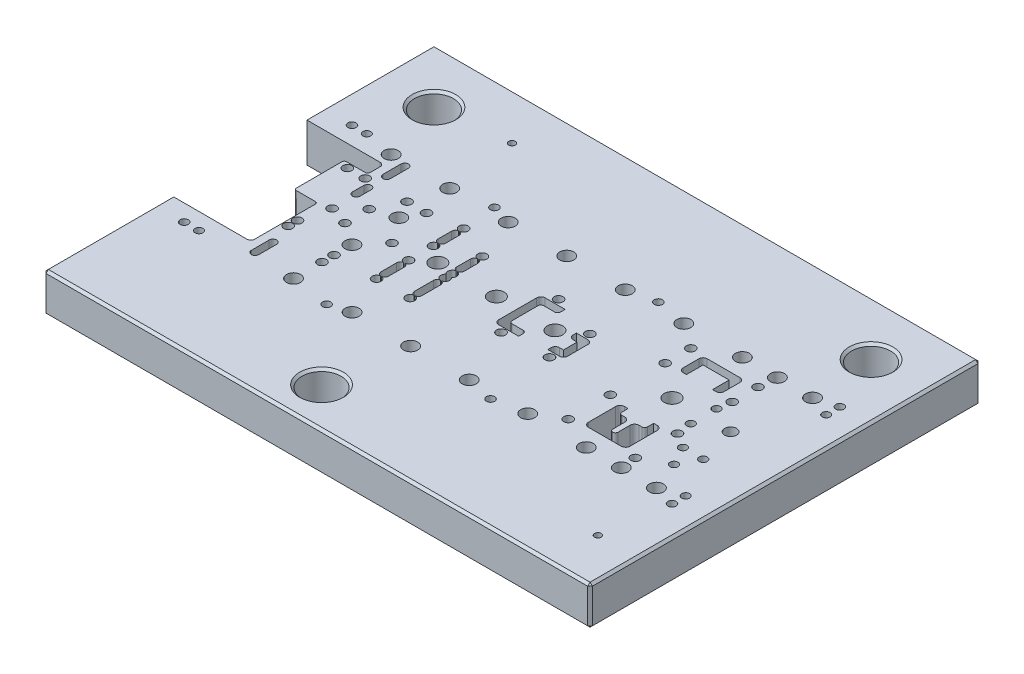
from build123d import *

# Parameters (mm, degrees)
SKETCH1_W                                            = 700
SKETCH1_H                                            = 500
BOSS_EXTRUDE1_DEPTH                                  = 50
CUT_EXTRUDE1_REACH                                   = 435.013
SKETCH2_R                                            = 25
CUT_EXTRUDE2_REACH                                   = 435.013
SKETCH3_R                                            = 5.113641914
SKETCH3_R_2                                          = 7.613641914
SKETCH4_R                                            = 9
SKETCH4_R_2                                          = 10
CUT_EXTRUDE3_DEPTH                                   = 23
F_11_5_11_5_DIAMETER_HOLE1_D                         = 11.5
CBORE_FOR_M10_HEX_SOCKET_HEAD_CAP_SCREW1_D           = 10.5
CBORE_FOR_M10_HEX_SOCKET_HEAD_CAP_SCREW1_CBORE_D     = 18
CBORE_FOR_M10_HEX_SOCKET_HEAD_CAP_SCREW1_CBORE_DEPTH = 10.6
F_10_0MM_DOWEL_HOLE1_D                               = 10
CUT_EXTRUDE4_REACH                                   = 435.013
CHAMFER1_SIZE                                        = 3
CHAMFER2_SIZE                                        = 3
M10_TAPPED_HOLE1_D                                   = 8.5
M10_TAPPED_HOLE1_DEPTH                               = 27.5
M10_TAPPED_HOLE1_TIP                                 = 2.553657631


with BuildPart() as part:
    # Sketch1 → Boss-Extrude1 (new body)
    with BuildSketch(Plane(origin=(0, 0, 0), x_dir=(1, 0, 0), z_dir=(0, 1, 0))):
        Rectangle(SKETCH1_W, SKETCH1_H)
    extrude(amount=-BOSS_EXTRUDE1_DEPTH)

    # Sketch2 → Cut-Extrude1 (cut, up to next)
    with BuildSketch(Plane(origin=(0, 0, 0), x_dir=(1, 0, 0), z_dir=(0, 1, 0)), mode=Mode.PRIVATE) as cut_extrude1_sk1:
        with Locations(Location((-280, 180, 0), (0, 0, 270))):
            Circle(SKETCH2_R)
    cut_extrude1_tool1 = extrude(cut_extrude1_sk1.sketch, amount=-CUT_EXTRUDE1_REACH, mode=Mode.PRIVATE) & part.part
    # Sketch2 → Cut-Extrude1 (cut, up to next)
    with BuildSketch(Plane(origin=(0, 0, 0), x_dir=(1, 0, 0), z_dir=(0, 1, 0)), mode=Mode.PRIVATE) as cut_extrude1_sk2:
        with Locations(Location((280, 180, 0), (0, 0, 270))):
            Circle(SKETCH2_R)
    cut_extrude1_tool2 = extrude(cut_extrude1_sk2.sketch, amount=-CUT_EXTRUDE1_REACH, mode=Mode.PRIVATE) & part.part
    # Sketch2 → Cut-Extrude1 (cut, up to next)
    with BuildSketch(Plane(origin=(0, 0, 0), x_dir=(1, 0, 0), z_dir=(0, 1, 0)), mode=Mode.PRIVATE) as cut_extrude1_sk3:
        with Locations(Location((-44, -200, 0), (0, 0, 270))):
            Circle(SKETCH2_R)
    cut_extrude1_tool3 = extrude(cut_extrude1_sk3.sketch, amount=-CUT_EXTRUDE1_REACH, mode=Mode.PRIVATE) & part.part
    add(cut_extrude1_tool1.solids().sort_by_distance((-280, 0, -180))[0], mode=Mode.SUBTRACT)
    add(cut_extrude1_tool2.solids().sort_by_distance((280, 0, -180))[0], mode=Mode.SUBTRACT)
    add(cut_extrude1_tool3.solids().sort_by_distance((-44, 0, 200))[0], mode=Mode.SUBTRACT)

    # Sketch3 → Cut-Extrude2 (cut, up to next)
    with BuildSketch(Plane.XZ.offset(50), mode=Mode.PRIVATE) as cut_extrude2_sk1:
        with Locations(Location((270.13, 62.64, 0), (0, 0, 270))):
            Circle(SKETCH3_R)
    cut_extrude2_tool1 = extrude(cut_extrude2_sk1.sketch, amount=-CUT_EXTRUDE2_REACH, mode=Mode.PRIVATE) & part.part
    # Sketch3 → Cut-Extrude2 (cut, up to next)
    with BuildSketch(Plane.XZ.offset(50), mode=Mode.PRIVATE) as cut_extrude2_sk2:
        with Locations(Location((283.13, 38.14, 0), (0, 0, 270))):
            Circle(SKETCH3_R)
    cut_extrude2_tool2 = extrude(cut_extrude2_sk2.sketch, amount=-CUT_EXTRUDE2_REACH, mode=Mode.PRIVATE) & part.part
    # Sketch3 → Cut-Extrude2 (cut, up to next)
    with BuildSketch(Plane.XZ.offset(50), mode=Mode.PRIVATE) as cut_extrude2_sk3:
        with Locations(Location((257.13, 38.14, 0), (0, 0, 270))):
            Circle(SKETCH3_R)
    cut_extrude2_tool3 = extrude(cut_extrude2_sk3.sketch, amount=-CUT_EXTRUDE2_REACH, mode=Mode.PRIVATE) & part.part
    # Sketch3 → Cut-Extrude2 (cut, up to next)
    with BuildSketch(Plane.XZ.offset(50), mode=Mode.PRIVATE) as cut_extrude2_sk4:
        with Locations(Location((235.63, 6.64, 0), (0, 0, 270))):
            Circle(SKETCH3_R)
    cut_extrude2_tool4 = extrude(cut_extrude2_sk4.sketch, amount=-CUT_EXTRUDE2_REACH, mode=Mode.PRIVATE) & part.part
    # Sketch3 → Cut-Extrude2 (cut, up to next)
    with BuildSketch(Plane.XZ.offset(50), mode=Mode.PRIVATE) as cut_extrude2_sk5:
        with Locations(Location((270.13, -9.86, 0), (0, 0, 270))):
            Circle(SKETCH3_R_2)
    cut_extrude2_tool5 = extrude(cut_extrude2_sk5.sketch, amount=-CUT_EXTRUDE2_REACH, mode=Mode.PRIVATE) & part.part
    # Sketch3 → Cut-Extrude2 (cut, up to next)
    with BuildSketch(Plane.XZ.offset(50), mode=Mode.PRIVATE) as cut_extrude2_sk6:
        with Locations(Location((235.63, -26.36, 0), (0, 0, 270))):
            Circle(SKETCH3_R)
    cut_extrude2_tool6 = extrude(cut_extrude2_sk6.sketch, amount=-CUT_EXTRUDE2_REACH, mode=Mode.PRIVATE) & part.part
    # Sketch3 → Cut-Extrude2 (cut, up to next)
    with BuildSketch(Plane.XZ.offset(50), mode=Mode.PRIVATE) as cut_extrude2_sk7:
        with BuildLine():
            Line((178.743641914, 30.026358086), (178.743641914, 38.14))
            ThreePointArc((178.743641914, 38.14), (179.735483234, 40.534516766), (182.13, 41.526358086))
            Line((182.13, 41.526358086), (186.13, 41.526358086))
            ThreePointArc((186.13, 41.526358086), (190.099444264, 43.170555736), (191.743641914, 47.14))
            Line((191.743641914, 47.14), (191.743641914, 62.64))
            ThreePointArc((191.743641914, 62.64), (195.13, 66.026358086), (198.516358086, 62.64))
            Line((198.516358086, 62.64), (198.516358086, 47.14))
            ThreePointArc((198.516358086, 47.14), (200.160555736, 43.170555736), (204.13, 41.526358086))
            Line((204.13, 41.526358086), (208.13, 41.526358086))
            ThreePointArc((208.13, 41.526358086), (210.524516766, 40.534516766), (211.516358086, 38.14))
            Line((211.516358086, 38.14), (211.516358086, 30.026358086))
            Line((211.516358086, 30.026358086), (216.13, 30.026358086))
            ThreePointArc((216.13, 30.026358086), (220.099444264, 31.670555736), (221.743641914, 35.64))
            Line((221.743641914, 35.64), (221.743641914, 70.64))
            ThreePointArc((221.743641914, 70.64), (220.099444264, 74.609444264), (216.13, 76.253641914))
            Line((216.13, 76.253641914), (174.13, 76.253641914))
            ThreePointArc((174.13, 76.253641914), (170.160555736, 74.609444264), (168.516358086, 70.64))
            Line((168.516358086, 70.64), (168.516358086, 35.64))
            ThreePointArc((168.516358086, 35.64), (170.160555736, 31.670555736), (174.13, 30.026358086))
            Line((174.13, 30.026358086), (178.743641914, 30.026358086))
        make_face()
    cut_extrude2_tool7 = extrude(cut_extrude2_sk7.sketch, amount=-CUT_EXTRUDE2_REACH, mode=Mode.PRIVATE) & part.part
    # Sketch3 → Cut-Extrude2 (cut, up to next)
    with BuildSketch(Plane.XZ.offset(50), mode=Mode.PRIVATE) as cut_extrude2_sk8:
        with BuildLine():
            Line((216.13, -45.067653611), (211.837653611, -45.067653611))
            Line((211.837653611, -45.067653611), (211.837653611, -66.347653611))
            Line((211.837653611, -66.347653611), (178.422346389, -66.347653611))
            Line((178.422346389, -66.347653611), (178.422346389, -45.067653611))
            Line((178.422346389, -45.067653611), (174.13, -45.067653611))
            ThreePointArc((174.13, -45.067653611), (170.38774598, -46.61774598), (168.837653611, -50.36))
            Line((168.837653611, -50.36), (168.837653611, -70.64))
            ThreePointArc((168.837653611, -70.64), (170.38774598, -74.38225402), (174.13, -75.932346389))
            Line((174.13, -75.932346389), (216.13, -75.932346389))
            ThreePointArc((216.13, -75.932346389), (219.87225402, -74.38225402), (221.422346389, -70.64))
            Line((221.422346389, -70.64), (221.422346389, -50.36))
            ThreePointArc((221.422346389, -50.36), (219.87225402, -46.61774598), (216.13, -45.067653611))
        make_face()
    cut_extrude2_tool8 = extrude(cut_extrude2_sk8.sketch, amount=-CUT_EXTRUDE2_REACH, mode=Mode.PRIVATE) & part.part
    # Sketch3 → Cut-Extrude2 (cut, up to next)
    with BuildSketch(Plane.XZ.offset(50), mode=Mode.PRIVATE) as cut_extrude2_sk9:
        with BuildLine():
            Line((72.337653611, 6.347653611), (72.337653611, -11.067653611))
            Line((72.337653611, -11.067653611), (67.13, -11.067653611))
            ThreePointArc((67.13, -11.067653611), (63.38774598, -12.61774598), (61.837653611, -16.36))
            Line((61.837653611, -16.36), (61.837653611, -20.652346389))
            Line((61.837653611, -20.652346389), (76.63, -20.652346389))
            ThreePointArc((76.63, -20.652346389), (80.37225402, -19.10225402), (81.922346389, -15.36))
            Line((81.922346389, -15.36), (81.922346389, 10.64))
            ThreePointArc((81.922346389, 10.64), (80.37225402, 14.38225402), (76.63, 15.932346389))
            Line((76.63, 15.932346389), (61.837653611, 15.932346389))
            Line((61.837653611, 15.932346389), (61.837653611, 11.64))
            ThreePointArc((61.837653611, 11.64), (63.38774598, 7.89774598), (67.13, 6.347653611))
            Line((67.13, 6.347653611), (72.337653611, 6.347653611))
        make_face()
    cut_extrude2_tool9 = extrude(cut_extrude2_sk9.sketch, amount=-CUT_EXTRUDE2_REACH, mode=Mode.PRIVATE) & part.part
    # Sketch3 → Cut-Extrude2 (cut, up to next)
    with BuildSketch(Plane.XZ.offset(50), mode=Mode.PRIVATE) as cut_extrude2_sk10:
        with BuildLine():
            Line((28.422346389, 19.932346389), (2.63, 19.932346389))
            ThreePointArc((2.63, 19.932346389), (-1.11225402, 18.38225402), (-2.662346389, 14.64))
            Line((-2.662346389, 14.64), (-2.662346389, -34.36))
            ThreePointArc((-2.662346389, -34.36), (-1.11225402, -38.10225402), (2.63, -39.652346389))
            Line((2.63, -39.652346389), (28.422346389, -39.652346389))
            Line((28.422346389, -39.652346389), (28.422346389, -33.86))
            ThreePointArc((28.422346389, -33.86), (27.311593849, -31.178406151), (24.63, -30.067653611))
            Line((24.63, -30.067653611), (10.63, -30.067653611))
            ThreePointArc((10.63, -30.067653611), (8.00829299, -28.98170701), (6.922346389, -26.36))
            Line((6.922346389, -26.36), (6.922346389, 6.64))
            ThreePointArc((6.922346389, 6.64), (8.00829299, 9.26170701), (10.63, 10.347653611))
            Line((10.63, 10.347653611), (24.63, 10.347653611))
            ThreePointArc((24.63, 10.347653611), (27.311593849, 11.458406151), (28.422346389, 14.14))
            Line((28.422346389, 14.14), (28.422346389, 19.932346389))
        make_face()
    cut_extrude2_tool10 = extrude(cut_extrude2_sk10.sketch, amount=-CUT_EXTRUDE2_REACH, mode=Mode.PRIVATE) & part.part
    # Sketch3 → Cut-Extrude2 (cut, up to next)
    with BuildSketch(Plane.XZ.offset(50), mode=Mode.PRIVATE) as cut_extrude2_sk11:
        with BuildLine():
            Line((-131.232166649, 36.69), (-131.232166649, 16.59))
            ThreePointArc((-131.232166649, 16.59), (-126.37, 11.727833351), (-121.507833351, 16.59))
            Line((-121.507833351, 16.59), (-121.507833351, 36.69))
            ThreePointArc((-121.507833351, 36.69), (-126.37, 41.552166649), (-131.232166649, 36.69))
        make_face()
    cut_extrude2_tool11 = extrude(cut_extrude2_sk11.sketch, amount=-CUT_EXTRUDE2_REACH, mode=Mode.PRIVATE) & part.part
    # Sketch3 → Cut-Extrude2 (cut, up to next)
    with BuildSketch(Plane.XZ.offset(50), mode=Mode.PRIVATE) as cut_extrude2_sk12:
        with BuildLine():
            Line((-88.162346389, 36.69), (-88.162346389, 12.59))
            ThreePointArc((-88.162346389, 12.59), (-83.37, 7.797653611), (-78.577653611, 12.59))
            Line((-78.577653611, 12.59), (-78.577653611, 36.69))
            ThreePointArc((-78.577653611, 36.69), (-83.37, 41.482346389), (-88.162346389, 36.69))
        make_face()
    cut_extrude2_tool12 = extrude(cut_extrude2_sk12.sketch, amount=-CUT_EXTRUDE2_REACH, mode=Mode.PRIVATE) & part.part
    # Sketch3 → Cut-Extrude2 (cut, up to next)
    with BuildSketch(Plane.XZ.offset(50), mode=Mode.PRIVATE) as cut_extrude2_sk13:
        with BuildLine():
            Line((-131.162346389, -36.31), (-131.162346389, -53.91))
            ThreePointArc((-131.162346389, -53.91), (-126.37, -58.702346389), (-121.577653611, -53.91))
            Line((-121.577653611, -53.91), (-121.577653611, -36.31))
            ThreePointArc((-121.577653611, -36.31), (-126.37, -31.517653611), (-131.162346389, -36.31))
        make_face()
    cut_extrude2_tool13 = extrude(cut_extrude2_sk13.sketch, amount=-CUT_EXTRUDE2_REACH, mode=Mode.PRIVATE) & part.part
    # Sketch3 → Cut-Extrude2 (cut, up to next)
    with BuildSketch(Plane.XZ.offset(50), mode=Mode.PRIVATE) as cut_extrude2_sk14:
        with BuildLine():
            Line((-88.162346389, -17.31), (-88.162346389, -34.91))
            ThreePointArc((-88.162346389, -34.91), (-83.37, -39.702346389), (-78.577653611, -34.91))
            Line((-78.577653611, -34.91), (-78.577653611, -17.31))
            ThreePointArc((-78.577653611, -17.31), (-83.37, -12.517653611), (-88.162346389, -17.31))
        make_face()
    cut_extrude2_tool14 = extrude(cut_extrude2_sk14.sketch, amount=-CUT_EXTRUDE2_REACH, mode=Mode.PRIVATE) & part.part
    # Sketch3 → Cut-Extrude2 (cut, up to next)
    with BuildSketch(Plane.XZ.offset(50), mode=Mode.PRIVATE) as cut_extrude2_sk15:
        with BuildLine():
            Line((-238.162346389, -72.87), (-238.162346389, -95.77))
            ThreePointArc((-238.162346389, -95.77), (-233.37, -100.562346389), (-228.577653611, -95.77))
            Line((-228.577653611, -95.77), (-228.577653611, -72.87))
            ThreePointArc((-228.577653611, -72.87), (-233.37, -68.077653611), (-238.162346389, -72.87))
        make_face()
    cut_extrude2_tool15 = extrude(cut_extrude2_sk15.sketch, amount=-CUT_EXTRUDE2_REACH, mode=Mode.PRIVATE) & part.part
    # Sketch3 → Cut-Extrude2 (cut, up to next)
    with BuildSketch(Plane.XZ.offset(50), mode=Mode.PRIVATE) as cut_extrude2_sk16:
        with BuildLine():
            Line((-238.162346389, 95.77), (-238.162346389, 72.87))
            ThreePointArc((-238.162346389, 72.87), (-233.37, 68.077653611), (-228.577653611, 72.87))
            Line((-228.577653611, 72.87), (-228.577653611, 95.77))
            ThreePointArc((-228.577653611, 95.77), (-233.37, 100.562346389), (-238.162346389, 95.77))
        make_face()
    cut_extrude2_tool16 = extrude(cut_extrude2_sk16.sketch, amount=-CUT_EXTRUDE2_REACH, mode=Mode.PRIVATE) & part.part
    # Sketch3 → Cut-Extrude2 (cut, up to next)
    with BuildSketch(Plane.XZ.offset(50), mode=Mode.PRIVATE) as cut_extrude2_sk17:
        with BuildLine():
            Line((-228.577653611, -48.36), (-228.577653611, -33.86))
            ThreePointArc((-228.577653611, -33.86), (-233.37, -29.067653611), (-238.162346389, -33.86))
            Line((-238.162346389, -33.86), (-238.162346389, -48.36))
            ThreePointArc((-238.162346389, -48.36), (-233.37, -53.152346389), (-228.577653611, -48.36))
        make_face()
    cut_extrude2_tool17 = extrude(cut_extrude2_sk17.sketch, amount=-CUT_EXTRUDE2_REACH, mode=Mode.PRIVATE) & part.part
    add(cut_extrude2_tool1.solids().sort_by_distance((270.13, -50, 62.64))[0], mode=Mode.SUBTRACT)
    add(cut_extrude2_tool2.solids().sort_by_distance((283.13, -50, 38.14))[0], mode=Mode.SUBTRACT)
    add(cut_extrude2_tool3.solids().sort_by_distance((257.13, -50, 38.14))[0], mode=Mode.SUBTRACT)
    add(cut_extrude2_tool4.solids().sort_by_distance((235.63, -50, 6.64))[0], mode=Mode.SUBTRACT)
    add(cut_extrude2_tool5.solids().sort_by_distance((270.13, -50, -9.86))[0], mode=Mode.SUBTRACT)
    add(cut_extrude2_tool6.solids().sort_by_distance((235.63, -50, -26.36))[0], mode=Mode.SUBTRACT)
    add(cut_extrude2_tool7.solids().sort_by_distance((176.436821, -50, 30.731348))[0], mode=Mode.SUBTRACT)
    add(cut_extrude2_tool8.solids().sort_by_distance((213.983827, -50, -45.67739))[0], mode=Mode.SUBTRACT)
    add(cut_extrude2_tool9.solids().sort_by_distance((73.54007, -50, -2.36))[0], mode=Mode.SUBTRACT)
    add(cut_extrude2_tool10.solids().sort_by_distance((15.526173, -50, 19.26029))[0], mode=Mode.SUBTRACT)
    add(cut_extrude2_tool11.solids().sort_by_distance((-126.37, -50, 26.64))[0], mode=Mode.SUBTRACT)
    add(cut_extrude2_tool12.solids().sort_by_distance((-83.37, -50, 24.64))[0], mode=Mode.SUBTRACT)
    add(cut_extrude2_tool13.solids().sort_by_distance((-126.37, -50, -45.11))[0], mode=Mode.SUBTRACT)
    add(cut_extrude2_tool14.solids().sort_by_distance((-83.37, -50, -26.11))[0], mode=Mode.SUBTRACT)
    add(cut_extrude2_tool15.solids().sort_by_distance((-233.37, -50, -84.32))[0], mode=Mode.SUBTRACT)
    add(cut_extrude2_tool16.solids().sort_by_distance((-233.37, -50, 84.32))[0], mode=Mode.SUBTRACT)
    add(cut_extrude2_tool17.solids().sort_by_distance((-233.37, -50, -41.11))[0], mode=Mode.SUBTRACT)

    # Sketch4 → Cut-Extrude3 (cut)
    with BuildSketch(Plane(origin=(0, 0, 0), x_dir=(1, 0, 0), z_dir=(0, 1, 0))):
        with Locations(Location((-29.87, -100, 0), (0, 0, 270))):
            Circle(SKETCH4_R)
        with Locations(Location((45.13, -100, 0), (0, 0, 270))):
            Circle(SKETCH4_R)
        with Locations(Location((120.13, -100, 0), (0, 0, 270))):
            Circle(SKETCH4_R)
        with Locations(Location((-104.87, 9.86, 0), (0, 0, 270))):
            Circle(SKETCH4_R_2)
        with Locations(Location((-29.87, 9.86, 0), (0, 0, 270))):
            Circle(SKETCH4_R_2)
        with Locations(Location((45.13, 9.86, 0), (0, 0, 270))):
            Circle(SKETCH4_R_2)
        with Locations(Location((195.13, 9.86, 0), (0, 0, 270))):
            Circle(SKETCH4_R_2)
        with Locations(Location((-104.87, 100, 0), (0, 0, 270))):
            Circle(SKETCH4_R)
        with Locations(Location((-29.87, 100, 0), (0, 0, 270))):
            Circle(SKETCH4_R)
        with Locations(Location((45.13, 100, 0), (0, 0, 270))):
            Circle(SKETCH4_R)
        with Locations(Location((120.13, 100, 0), (0, 0, 270))):
            Circle(SKETCH4_R)
        with Locations(Location((195.13, 100, 0), (0, 0, 270))):
            Circle(SKETCH4_R)
        with Locations(Location((240, 100, 0), (0, 0, 270))):
            Circle(SKETCH4_R)
        with Locations(Location((285, 100, 0), (0, 0, 270))):
            Circle(SKETCH4_R)
        with Locations(Location((195.13, -100, 0), (0, 0, 270))):
            Circle(SKETCH4_R)
        with Locations(Location((240, -100, 0), (0, 0, 270))):
            Circle(SKETCH4_R)
        with Locations(Location((285, -100, 0), (0, 0, 270))):
            Circle(SKETCH4_R)
        with Locations(Location((-179.87, 100, 0), (0, 0, 270))):
            Circle(SKETCH4_R)
        with Locations(Location((-179.87, -100, 0), (0, 0, 270))):
            Circle(SKETCH4_R)
        with Locations(Location((-104.87, -100, 0), (0, 0, 270))):
            Circle(SKETCH4_R)
        with Locations(Location((-254.87, 100, 0), (0, 0, 270))):
            Circle(SKETCH4_R)
        with Locations(Location((-179.87, -25.14, 0), (0, 0, 270))):
            Circle(SKETCH4_R)
        with Locations(Location((-179.87, 34.86, 0), (0, 0, 270))):
            Circle(SKETCH4_R)
    extrude(amount=-CUT_EXTRUDE3_DEPTH, mode=Mode.SUBTRACT)

    # Ø11.5 (11.5) Diameter Hole1 (through all)
    with Locations(Plane(origin=(0, -50, 0), x_dir=(-1, 0, 0), z_dir=(0, -1, 0))):
        with Locations((267.87, 56.92), (245.000667118, 56.92), (232.87, 2.36), (208.37, -5.64), (208.37, 25.36), (241.62, -33.14), (241.62, -45.14), (179.87, -48.14), (179.87, -63.64), (192.37, 57.86), (167.37, 57.86), (126.37, 64.36), (126.37, 25.86), (126.37, -47.14), (126.37, -6.14), (156.12, 2.36), (83.37, -47.14), (83.37, -2.14), (83.37, 6.86), (83.37, 45.36), (-12.94, -26.986173195), (-12.94, 46.706173195), (-71.5, 28.206173195), (-71.5, -23.486173195), (-152.13, -80.14), (-152.13, -26.14), (-238.13, -80.14), (-238.13, -26.14), (-152.13, 44), (-152.13, 77), (-238.13, 44), (-238.13, 77)):
            Hole(F_11_5_11_5_DIAMETER_HOLE1_D / 2)

    # CBORE for M10 Hex Socket Head Cap Screw1 (through all)
    with Locations(Plane(origin=(0, -50, 0), x_dir=(-1, 0, 0), z_dir=(0, -1, 0))):
        with Locations((-312.5, 107.5), (-80, 107.5), (-80, -107.5), (130, -107.5), (-312.5, -107.5), (130, 107.5), (312.5, 107.5), (312.5, -107.5)):
            CounterBoreHole(CBORE_FOR_M10_HEX_SOCKET_HEAD_CAP_SCREW1_D / 2, CBORE_FOR_M10_HEX_SOCKET_HEAD_CAP_SCREW1_CBORE_D / 2, CBORE_FOR_M10_HEX_SOCKET_HEAD_CAP_SCREW1_CBORE_DEPTH)

    # Ø10.0mm Dowel Hole1 (through all)
    with Locations(Plane(origin=(0, -50, 0), x_dir=(-1, 0, 0), z_dir=(0, -1, 0))):
        with Locations((-312.5, 90), (-312.5, -90), (293.5, -107.5), (293.5, 107.5)):
            Hole(F_10_0MM_DOWEL_HOLE1_D / 2)

    # Sketch20 → Cut-Extrude4 (cut, up to next)
    with BuildSketch(Plane(origin=(0, 0, 0), x_dir=(1, 0, 0), z_dir=(0, 1, 0)), mode=Mode.PRIVATE) as cut_extrude4_sk1:
        with BuildLine():
            Line((-350, 84.36), (-350, -86.262387825))
            Line((-350, -86.262387825), (-253.37, -86.262387825))
            ThreePointArc((-253.37, -86.262387825), (-249.834466094, -84.797921731), (-248.37, -81.262387825))
            Line((-248.37, -81.262387825), (-248.37, -3.64))
            ThreePointArc((-248.37, -3.64), (-249.248679656, -1.518679656), (-251.37, -0.64))
            Line((-251.37, -0.64), (-275.37, -0.64))
            ThreePointArc((-275.37, -0.64), (-277.491320344, 0.238679656), (-278.37, 2.36))
            Line((-278.37, 2.36), (-278.37, 60.48))
            ThreePointArc((-278.37, 60.48), (-277.491320344, 62.601320344), (-275.37, 63.48))
            Line((-275.37, 63.48), (-251.37, 63.48))
            ThreePointArc((-251.37, 63.48), (-249.248679656, 64.358679656), (-248.37, 66.48))
            Line((-248.37, 66.48), (-248.37, 79.36))
            ThreePointArc((-248.37, 79.36), (-249.834466094, 82.895533906), (-253.37, 84.36))
            Line((-253.37, 84.36), (-350, 84.36))
        make_face()
    cut_extrude4_tool1 = extrude(cut_extrude4_sk1.sketch, amount=-CUT_EXTRUDE4_REACH, mode=Mode.PRIVATE) & part.part
    add(cut_extrude4_tool1.solids().sort_by_distance((-303.69867, 0, 4.993069))[0], mode=Mode.SUBTRACT)

    # Chamfer1
    chamfer1_edges = [part.edges().sort_by_distance(p)[0] for p in [
        (-280, -50, -205),
        (-280, 0, -205),
        (280, -50, -205),
        (280, 0, -205),
        (-44, -50, 175),
        (-44, 0, 175),
    ]]
    chamfer(chamfer1_edges, length=CHAMFER1_SIZE)

    # Chamfer2
    chamfer2_edges = [part.edges().sort_by_distance(p)[0] for p in [
        (-350, -50, -167.18),
        (0, -50, 250),
        (350, -50, 0),
        (0, 0, 250),
        (-350, 0, -167.18),
        (0, 0, -250),
        (350, 0, 0),
        (350, -25, 250),
        (-350, -25, 250),
        (-350, -25, -250),
        (350, -25, -250),
        (0, -50, -250),
        (-350, 0, 168.131193913),
        (-350, -50, 168.131193913),
        (-350, -25, 86.262387825),
        (-350, -25, -84.36),
    ]]
    chamfer(chamfer2_edges, length=CHAMFER2_SIZE)

    # M10 Tapped Hole1
    with Locations(Plane(origin=(0, 0, 0), x_dir=(1, 0, 0), z_dir=(0, 1, 0))):
        with Locations((300, -190), (-190, 190)):
            Hole(M10_TAPPED_HOLE1_D / 2, depth=M10_TAPPED_HOLE1_DEPTH)
            with Locations((0, 0, -(M10_TAPPED_HOLE1_DEPTH + M10_TAPPED_HOLE1_TIP / 2))):  # 118° drill point
                Cone(0, M10_TAPPED_HOLE1_D / 2, M10_TAPPED_HOLE1_TIP, mode=Mode.SUBTRACT)


solid = part.part
